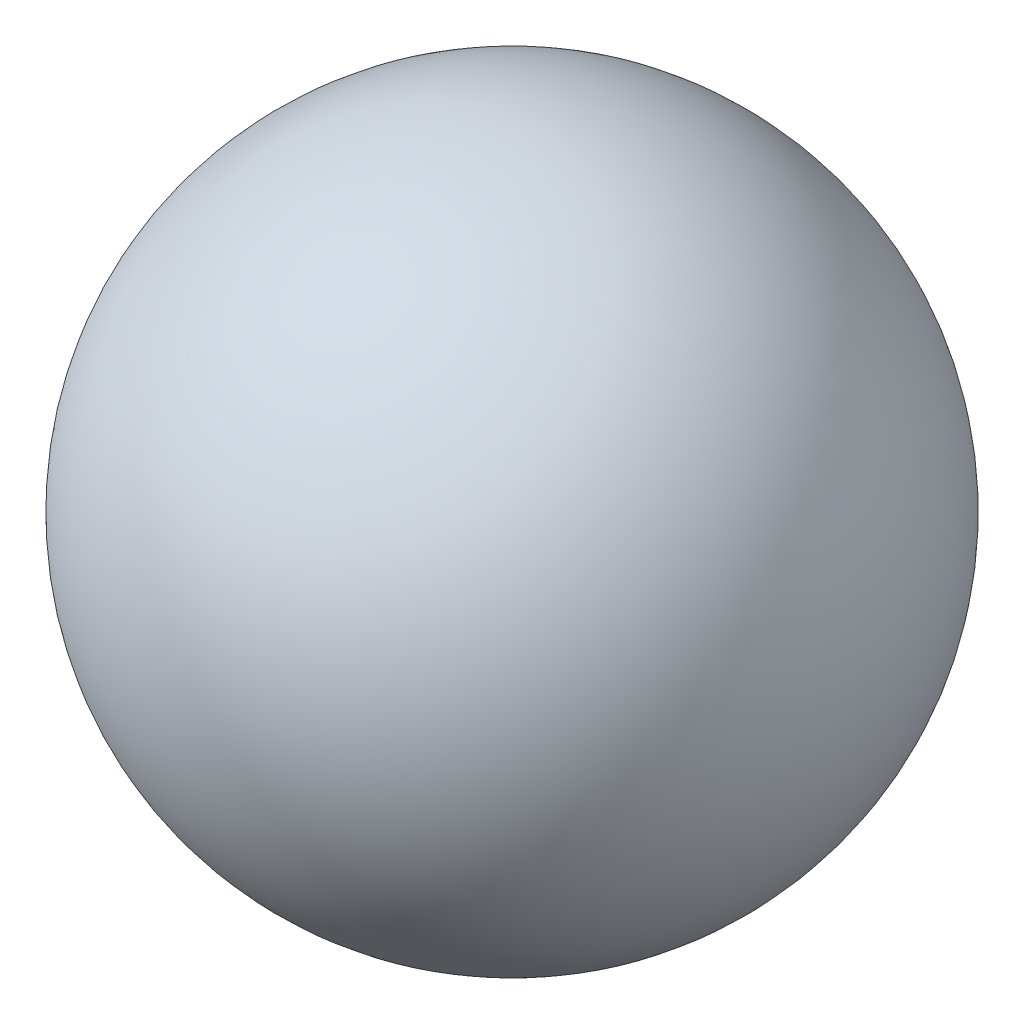
from build123d import *


with BuildPart() as part:
    # Sketch1 → Revolve2 (revolve)
    with BuildSketch(Plane.XY):
        with BuildLine():
            Line((0, 36.5), (0, -36.5))
            ThreePointArc((0, -36.5), (36.5, 0), (0, 36.5))
        make_face()
    revolve(axis=Axis((0, 0, 0), (0, -1, 0)))


solid = part.part
